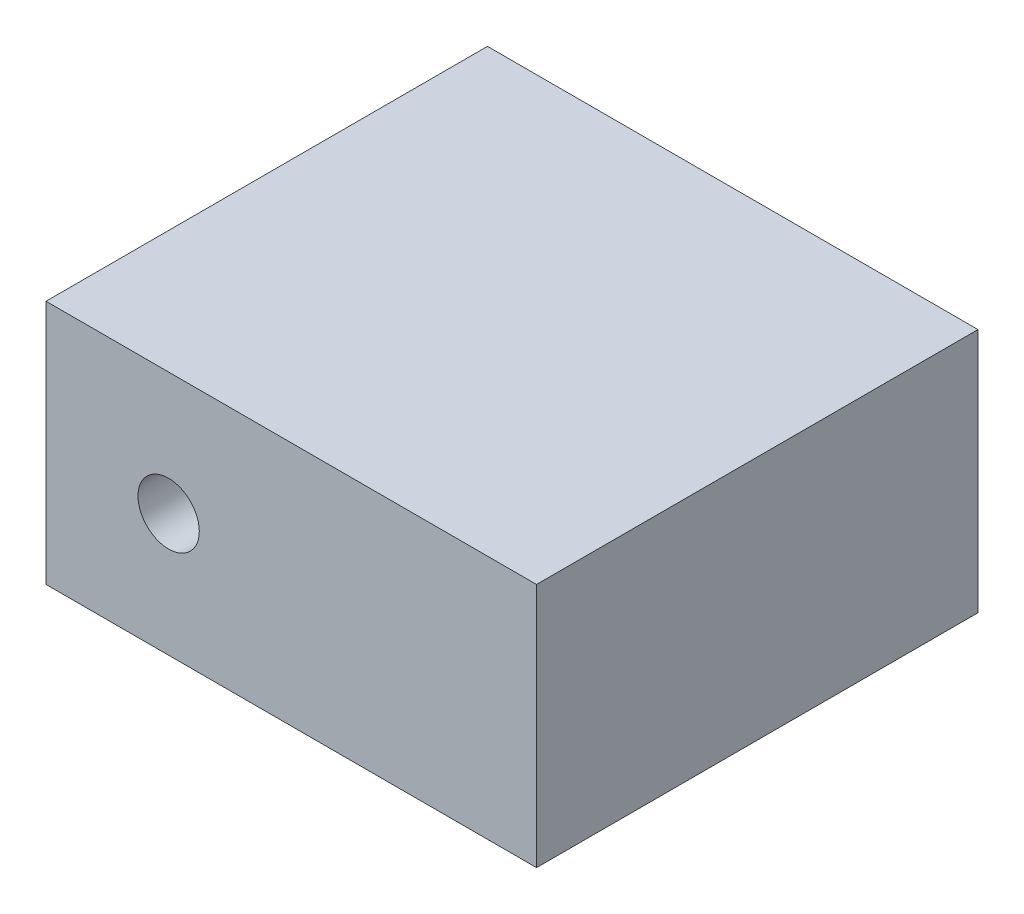
from build123d import *

# Parameters (mm, degrees)
ESQUISSE1_W             = 40
ESQUISSE1_H             = 20
BOSS_EXTRU_1_DEPTH      = 18
ESQUISSE2_R             = 2.5
ENL_V_MAT_EXTRU_1_DEPTH = 10


with BuildPart() as part:
    # Esquisse1 → Boss.-Extru.1 (new, symmetric)
    with BuildSketch(Plane.XY):
        with Locations((20, 10)):
            Rectangle(ESQUISSE1_W, ESQUISSE1_H)
    extrude(amount=BOSS_EXTRU_1_DEPTH, both=True)

    # Esquisse2 → Enlèv. mat.-Extru.1 (cut)
    with BuildSketch(Plane.XY.offset(18)):
        with Locations((10, 10)):
            Circle(ESQUISSE2_R)
    extrude(amount=-ENL_V_MAT_EXTRU_1_DEPTH, mode=Mode.SUBTRACT)


solid = part.part
